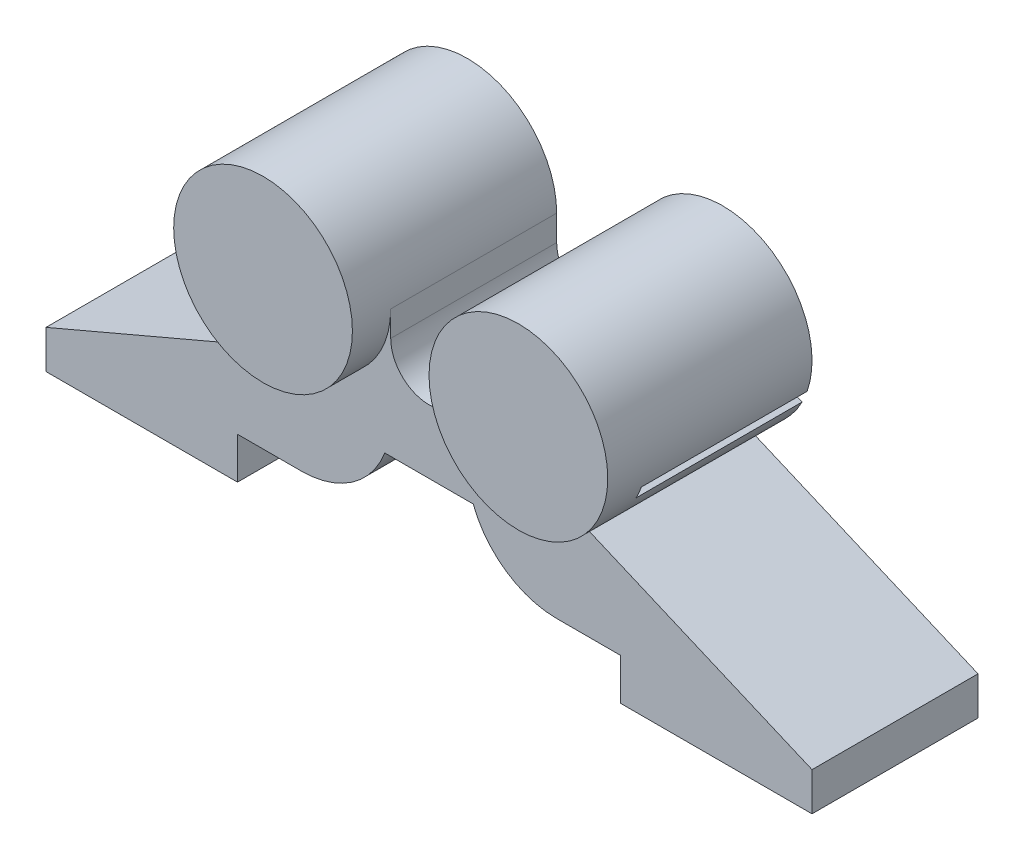
from build123d import *

# Parameters (mm, degrees)
SKETCH1_R           = 7
BOSS_EXTRUDE1_DEPTH = 13
SKETCH2_R           = 7
BOSS_EXTRUDE2_DEPTH = 3
SKETCH3_R           = 3
CUT_EXTRUDE1_DEPTH  = 13


with BuildPart() as part:
    # Sketch1 → Boss-Extrude1 (new body)
    with BuildSketch(Plane.XY):
        with Locations((10, 0)):
            Circle(SKETCH1_R)
        with BuildLine():
            ThreePointArc((3.461651585, -10), (6.031373033, -13.266281297), (10, -14.5))
            Line((10, -14.5), (15, -14.5))
            Line((15, -14.5), (15, -17.75))
            Line((15, -17.75), (30, -17.75))
            Line((30, -17.75), (30, -14.75))
            Line((30, -14.75), (16.808917195, -9.124391157))
            Line((16.808917195, -9.124391157), (11.464397441, -6.845110674))
            ThreePointArc((11.464397441, -6.845110674), (5.598340205, -5.442921187), (3, 0))
            Line((3, 0), (3, -2))
            ThreePointArc((3, -2), (2.121320344, -4.121320344), (0, -5))
            Line((0, -5), (0, -10))
            Line((0, -10), (3.461651585, -10))
        make_face()
    extrude(amount=BOSS_EXTRUDE1_DEPTH)

    # Sketch2 → Boss-Extrude2 (add)
    with BuildSketch(Plane.XY.offset(13)):
        with Locations(Location((10, 0, 0), (0, 0, 180))):
            Circle(SKETCH2_R)
    extrude(amount=BOSS_EXTRUDE2_DEPTH)

    # Sketch3 → Cut-Extrude1 (cut)
    with BuildSketch(Plane.XY):
        with Locations((10, 0)):
            Circle(SKETCH3_R)
        with BuildLine():
            ThreePointArc((12.917076099, -0.70047629), (12.759529774, -1.176858286), (12.524790004, -1.620319548))
            Line((12.524790004, -1.620319548), (16.664084665, -3.385606977))
            Line((16.664084665, -3.385606977), (17.05637076, -2.465763719))
            Line((17.05637076, -2.465763719), (12.917076099, -0.70047629))
        make_face()
    extrude(amount=CUT_EXTRUDE1_DEPTH, mode=Mode.SUBTRACT)

    # Mirror1: part across plane


with BuildPart() as part_1:
    add(part.part)
    add(part.part.mirror(Plane(origin=(0, 0, 0), x_dir=(0, 0, 1), z_dir=(1, 0, 0))))


solid = part_1.part
